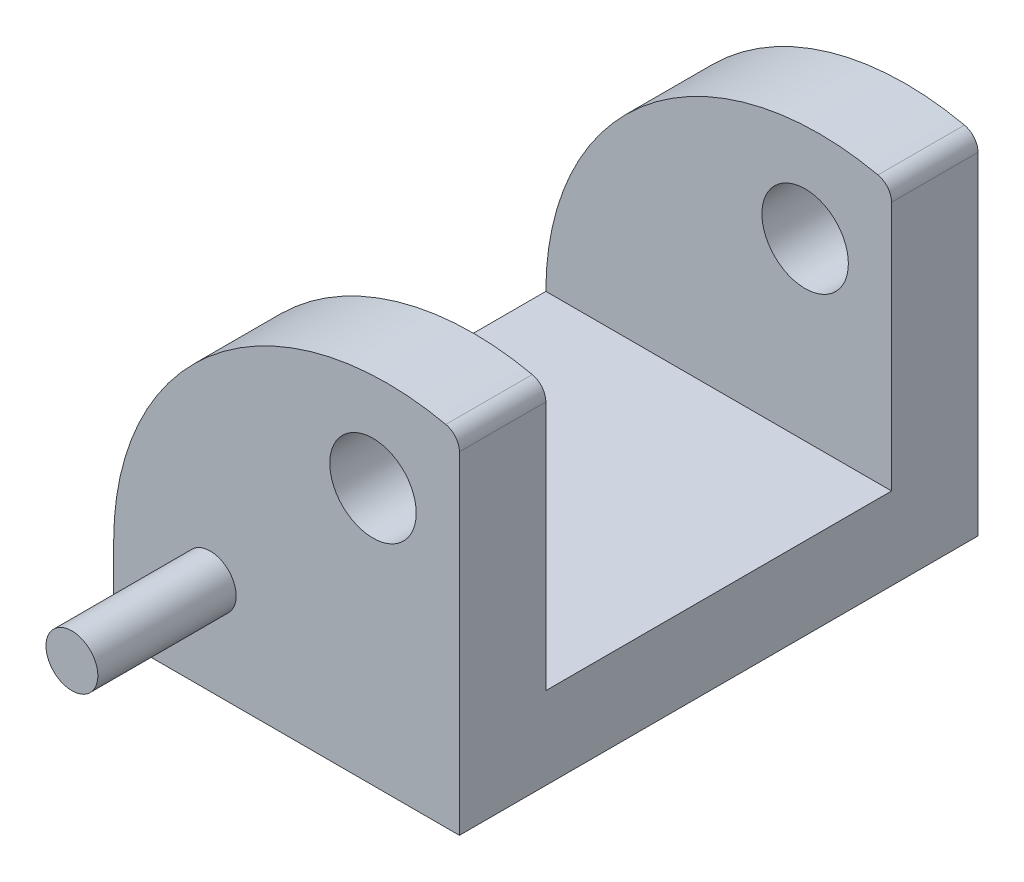
from build123d import *

# Parameters (mm, degrees)
SKETCH1_R               = 63.5
BOSS_EXTRUDE1_DEPTH     = 762
CUT_EXTRUDE1_DEPTH      = 1032.82015403
CUT_EXTRUDE1_DEPTH_BACK = 387.260908
SKETCH2_W               = 765.404618736
SKETCH2_H               = 508
SKETCH3_R               = 38.1
BOSS_EXTRUDE2_DEPTH     = 203.2
FILLET1_R               = 25.4


with BuildPart() as part:
    # Sketch1 → Boss-Extrude1 (new body)
    with BuildSketch(Plane.XY):
        with BuildLine():
            Line((-475.33654421, 0), (32.66345579, 0))
            Line((32.66345579, 0), (32.66345579, 508))
            ThreePointArc((32.66345579, 508), (-317.204687381, 440.127182905), (-475.33654421, 120.739091765))
            Line((-475.33654421, 120.739091765), (-475.33654421, 0))
        make_face()
        with Locations((-94.33654421, 378.291313639)):
            Circle(SKETCH1_R, mode=Mode.SUBTRACT)
    extrude(amount=BOSS_EXTRUDE1_DEPTH)

    # Sketch2 → Cut-Extrude1 (cut, two sides: drawn at the far end of the back side and taken through both)
    with BuildSketch(Plane(origin=(0, 508, 0), x_dir=(1, 0, 0), z_dir=(0, 1, 0)).offset(-CUT_EXTRUDE1_DEPTH_BACK)):
        with Locations((-173.345287356, -381)):
            Rectangle(SKETCH2_W, SKETCH2_H)
    extrude(amount=CUT_EXTRUDE1_DEPTH + CUT_EXTRUDE1_DEPTH_BACK, mode=Mode.SUBTRACT)

    # Sketch3 → Boss-Extrude2 (add)
    with BuildSketch(Plane.XY.offset(762)):
        with Locations(Location((-333.507660116, 140.616973841, 0), (0, 0, 180))):
            Circle(SKETCH3_R)
    boss_extrude2 = extrude(amount=BOSS_EXTRUDE2_DEPTH)

    # Mirror1: Boss-Extrude2 across plane
    add(boss_extrude2.mirror(Plane.XY.offset(381)))

    # Fillet1
    fillet1_edges = [part.edges().sort_by_distance(p)[0] for p in [
        (32.66345579, 508, 63.5),
        (32.66345579, 508, 698.5),
    ]]
    fillet(fillet1_edges, radius=FILLET1_R)


solid = part.part
